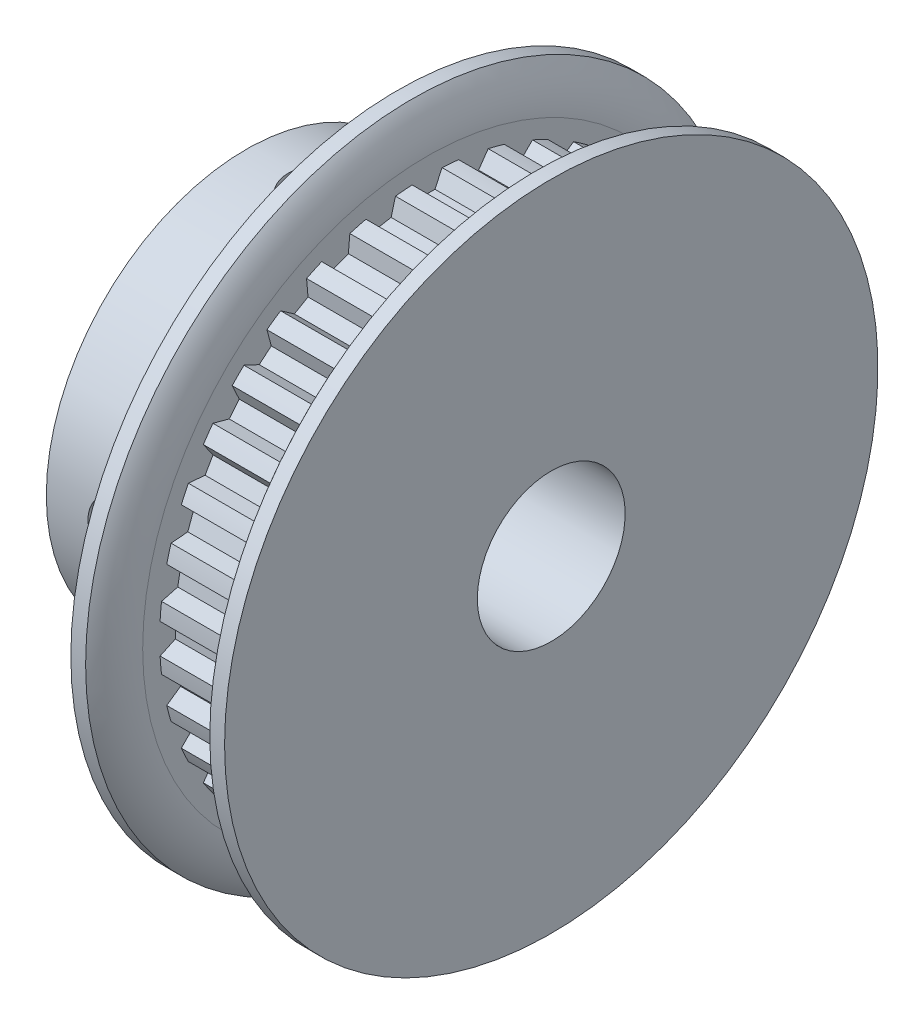
from build123d import *

# Parameters (mm, degrees)
SKETCH4_R          = 11.6459
SKETCH4_R_2        = 11.48715
CUT_EXTRUDE2_DEPTH = 4.064
CUT_EXTRUDE1_DEPTH = 4.064
CIRPATTERN1_COUNT  = 36
SKETCH6_R          = 1.4605
CUT_EXTRUDE3_DEPTH = 21.900303221
CUT_EXTRUDE4_DEPTH = 1.016
CIRPATTERN2_COUNT  = 2
CIRPATTERN2_ANGLE  = 90
CIRPATTERN3_COUNT  = 2
CIRPATTERN3_ANGLE  = 90


with BuildPart() as part:
    # Sketch1 → Revolve1 (revolve)
    with BuildSketch(Plane.XY, mode=Mode.PRIVATE) as revolve1_sk:
        with BuildLine():
            Line((-6.5532, 3.175), (6.5532, 3.175))
            Line((6.5532, 3.175), (6.5532, 14.0335))
            Line((6.5532, 14.0335), (5.9182, 14.0335))
            ThreePointArc((5.9182, 14.0335), (5.446526303, 13.179356887), (5.2832, 12.2174))
            Line((5.2832, 12.2174), (5.2832, 11.6459))
            Line((5.2832, 11.6459), (1.2192, 11.6459))
            Line((1.2192, 11.6459), (1.2192, 12.2174))
            ThreePointArc((1.2192, 12.2174), (1.055873697, 13.179356887), (0.5842, 14.0335))
            Line((0.5842, 14.0335), (-0.0508, 14.0335))
            Line((-0.0508, 14.0335), (-0.0508, 8.5852))
            Line((-0.0508, 8.5852), (-6.5532, 8.5852))
            Line((-6.5532, 8.5852), (-6.5532, 3.175))
        make_face()
    revolve(revolve1_sk.sketch.rotate(Axis((-6.5532, 0, 0), (1, 0, 0)), 90), axis=Axis((-6.5532, 0, 0), (1, 0, 0)))

    # Sketch4 → Cut-Extrude2 (cut)
    with BuildSketch(Plane(origin=(1.2192, 0, 0), x_dir=(0, 0, -1), z_dir=(1, 0, 0))):
        Circle(SKETCH4_R)
        Circle(SKETCH4_R_2, mode=Mode.SUBTRACT)
    extrude(amount=CUT_EXTRUDE2_DEPTH, mode=Mode.SUBTRACT)

    # Sketch3 → Cut-Extrude1 (cut)
    with BuildSketch(Plane(origin=(1.2192, 0, 0), x_dir=(0, 0, -1), z_dir=(1, 0, 0))):
        with BuildLine():
            Line((-0.643832637, 11.469093018), (-0.338867174, 10.815092473))
            Line((-0.338867174, 10.815092473), (0.338867174, 10.815092473))
            Line((0.338867174, 10.815092473), (0.643832637, 11.469093018))
            ThreePointArc((0.643832637, 11.469093018), (0, 11.48715), (-0.643832637, 11.469093018))
        make_face()
    cut_extrude1 = extrude(amount=CUT_EXTRUDE1_DEPTH, mode=Mode.SUBTRACT)

    # CirPattern1: Cut-Extrude1 ×36 about axis
    cirpattern1_axis = Axis((0, 0, 0), (1, 0, 0))
    for i in range(1, CIRPATTERN1_COUNT):
        add(cut_extrude1.rotate(cirpattern1_axis, i * 360 / CIRPATTERN1_COUNT), mode=Mode.SUBTRACT)

    # Sketch6 → Cut-Extrude3 (cut, through all)
    with BuildSketch(Plane(origin=(0, 0, 0), x_dir=(1, 0, 0), z_dir=(0, 1, 0))):
        with Locations(Location((-3.302, 0, 0), (0, 0, 90))):
            Circle(SKETCH6_R)
    cut_extrude3 = extrude(amount=CUT_EXTRUDE3_DEPTH, mode=Mode.SUBTRACT)

    # CirPattern2: Cut-Extrude3 ×2 about axis
    cirpattern2_axis = Axis((-6.5532, 0, 0), (1, 0, 0))
    for i in range(1, CIRPATTERN2_COUNT):
        add(cut_extrude3.rotate(cirpattern2_axis, i * CIRPATTERN2_ANGLE / (CIRPATTERN2_COUNT - 1)), mode=Mode.SUBTRACT)


with BuildPart() as body_2:
    # Sketch7 → Revolve2 (revolve)
    with BuildSketch(Plane.XY, mode=Mode.PRIVATE) as revolve2_sk:
        Polygon((-4.4704, 8.5852), (-3.302, 8.5852), (-3.302, 3.556), (-4.4704, 3.556), (-4.7244, 3.81), (-4.7244, 8.3312), align=None)
    revolve(revolve2_sk.sketch.rotate(Axis((-3.302, 3.556, 0), (0, 1, 0)), 270), axis=Axis((-3.302, 3.556, 0), (0, 1, 0)))

    # Sketch8 → Cut-Extrude4 (cut)
    with BuildSketch(Plane(origin=(0, 8.5852, 0), x_dir=(1, 0, 0), z_dir=(0, 1, 0))):
        Polygon((-3.302, 0.821223023), (-4.0132, 0.410611511), (-4.0132, -0.410611511), (-3.302, -0.821223023), (-2.5908, -0.410611511), (-2.5908, 0.410611511), align=None)
    extrude(amount=-CUT_EXTRUDE4_DEPTH, mode=Mode.SUBTRACT)


with BuildPart() as cirpattern3_1:
    # CirPattern3: pattern copy
    add(body_2.part.rotate(Axis((0, 0, 0), (1, 0, 0)), 1 * CIRPATTERN3_ANGLE / (CIRPATTERN3_COUNT - 1)))


solid = Compound([part.part, body_2.part, cirpattern3_1.part])
